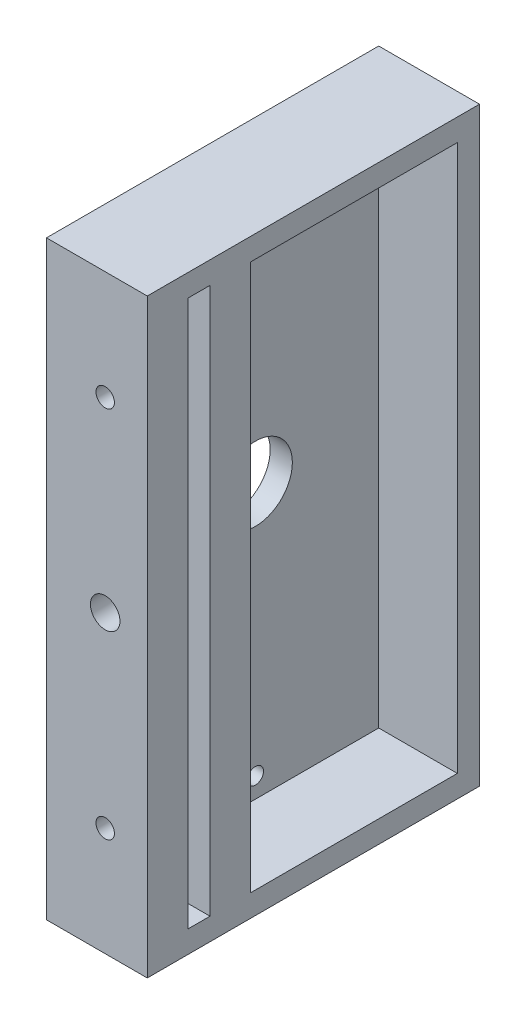
from build123d import *

# Parameters (mm, degrees)
SKETCH1_W           = 10.6496793
SKETCH1_H           = 5.5
SKETCH1_W_2         = 3
SKETCH1_H_2         = 45
BOSS_EXTRUDE1_DEPTH = 80
SKETCH2_R           = 2
SKETCH2_R_2         = 1.25
CUT_EXTRUDE1_DEPTH  = 87.830296046
SKETCH3_R           = 5
SKETCH3_R_2         = 1.0922
CUT_EXTRUDE2_DEPTH  = 10
SKETCH4_W           = 28
SKETCH4_H           = 3
SKETCH4_W_2         = 8.5
BOSS_EXTRUDE2_DEPTH = 10.6496793


with BuildPart() as part:
    # Sketch1 → Boss-Extrude1 (new body)
    with BuildSketch(Plane(origin=(0, 0, 0), x_dir=(1, 0, 0), z_dir=(0, 1, 0))):
        with Locations((8.035561223, -6.751971663)):
            Rectangle(SKETCH1_W, SKETCH1_H)
        with Locations((1.210721573, 4.498028337)):
            Rectangle(SKETCH1_W_2, SKETCH1_H_2)
        with Locations((8.035561223, -15.251971663)):
            Rectangle(SKETCH1_W, SKETCH1_H)
    extrude(amount=BOSS_EXTRUDE1_DEPTH)

    # Sketch2 → Cut-Extrude1 (cut, through all)
    with BuildSketch(Plane(origin=(0, 0, 4.001971663), x_dir=(-1, 0, 0), z_dir=(0, 0, -1))):
        with Locations((-7.660400873, 40)):
            Circle(SKETCH2_R)
        with Locations((-7.660400873, 65.273758001)):
            Circle(SKETCH2_R_2)
        with Locations((-7.660400873, 14.726241999)):
            Circle(SKETCH2_R_2)
    extrude(amount=-CUT_EXTRUDE1_DEPTH, mode=Mode.SUBTRACT)

    # Sketch3 → Cut-Extrude2 (cut)
    with BuildSketch(Plane(origin=(2.710721573, 0, 0), x_dir=(0, 0, -1), z_dir=(1, 0, 0))):
        with Locations((7.298028337, 40)):
            Circle(SKETCH3_R)
        with Locations((7.298028337, 74.25)):
            Circle(SKETCH3_R_2)
        with Locations((7.298028337, 5.75)):
            Circle(SKETCH3_R_2)
    extrude(amount=-CUT_EXTRUDE2_DEPTH, mode=Mode.SUBTRACT)

    # Sketch4 → Boss-Extrude2 (add)
    with BuildSketch(Plane(origin=(2.710721573, 0, 0), x_dir=(0, 0, -1), z_dir=(1, 0, 0))):
        Polygon((26.998028337, 0), (26.998028337, 80), (23.998028337, 80), (23.998028337, 77), (23.998028337, 3), (23.998028337, 0), align=None)
        with Locations((9.998028337, 78.5)):
            Rectangle(SKETCH4_W, SKETCH4_H)
        with Locations((9.998028337, 1.5)):
            Rectangle(SKETCH4_W, SKETCH4_H)
        with Locations((-8.251971663, 78.5)):
            Rectangle(SKETCH4_W_2, SKETCH4_H)
        with Locations((-8.251971663, 1.5)):
            Rectangle(SKETCH4_W_2, SKETCH4_H)
    extrude(amount=BOSS_EXTRUDE2_DEPTH)


solid = part.part
